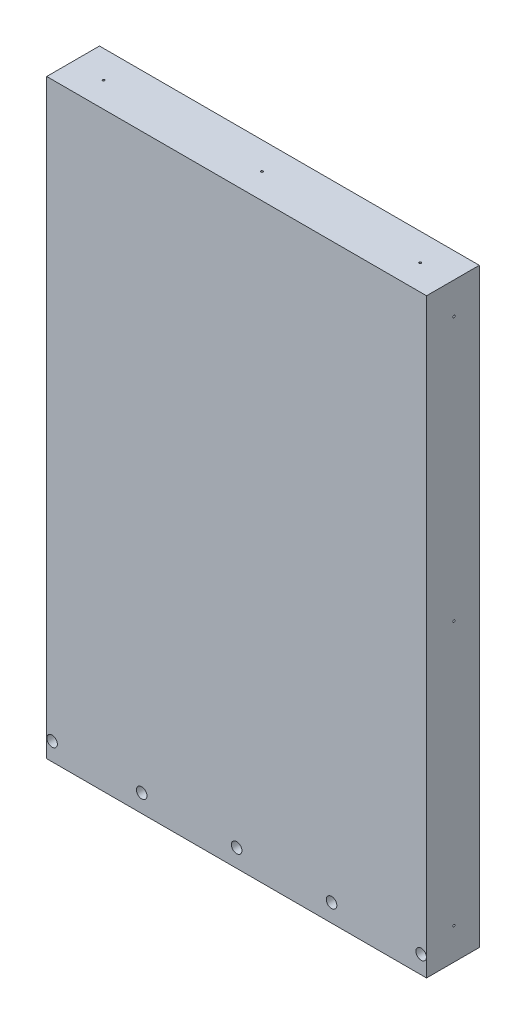
from build123d import *

# Parameters (mm, degrees)
ESBO_O1_W                      = 180
ESBO_O1_H                      = 280
ESBO_O1_R                      = 2.5
RESSALTO_EXTRUS_O3_DEPTH       = 25
FURO_DE_DI_METRO_1_0_1_1_D     = 1
FURO_DE_DI_METRO_1_0_1_1_DEPTH = 10
FURO_DE_DI_METRO_1_0_1_1_TIP   = 0.30043031
FURO_DE_DI_METRO_1_0_1_2_D     = 1
FURO_DE_DI_METRO_1_0_1_2_DEPTH = 10
FURO_DE_DI_METRO_1_0_1_2_TIP   = 0.30043031
FURO_DE_DI_METRO_1_0_1_3_D     = 1
FURO_DE_DI_METRO_1_0_1_3_DEPTH = 10
FURO_DE_DI_METRO_1_0_1_3_TIP   = 0.30043031
FURO_DE_DI_METRO_1_0_1_4_D     = 1
FURO_DE_DI_METRO_1_0_1_4_DEPTH = 10
FURO_DE_DI_METRO_1_0_1_4_TIP   = 0.30043031


with BuildPart() as part:
    # Esboço1 → Ressalto-extrusão3 (new body)
    with BuildSketch(Plane.XY):
        with Locations((90, 140)):
            Rectangle(ESBO_O1_W, ESBO_O1_H)
        with Locations((2.55, 8.5)):
            Circle(ESBO_O1_R, mode=Mode.SUBTRACT)
        with Locations((45, 8.5)):
            Circle(ESBO_O1_R, mode=Mode.SUBTRACT)
        with Locations((90, 8.5)):
            Circle(ESBO_O1_R, mode=Mode.SUBTRACT)
        with Locations((135, 8.5)):
            Circle(ESBO_O1_R, mode=Mode.SUBTRACT)
        with Locations((177.45, 8.5)):
            Circle(ESBO_O1_R, mode=Mode.SUBTRACT)
    extrude(amount=RESSALTO_EXTRUS_O3_DEPTH)

    # Furo de diâmetro Ø1.0 (1)1
    with Locations(Plane(origin=(0, 265, 12), x_dir=(0, 0, -1), z_dir=(-1, 0, 0))):
        with Locations((0, 0), (0, 125), (0, 250)):
            Hole(FURO_DE_DI_METRO_1_0_1_1_D / 2, depth=FURO_DE_DI_METRO_1_0_1_1_DEPTH)
            with Locations((0, 0, -(FURO_DE_DI_METRO_1_0_1_1_DEPTH + FURO_DE_DI_METRO_1_0_1_1_TIP / 2))):  # 118° drill point
                Cone(0, FURO_DE_DI_METRO_1_0_1_1_D / 2, FURO_DE_DI_METRO_1_0_1_1_TIP, mode=Mode.SUBTRACT)

    # Furo de diâmetro Ø1.0 (1)2
    with Locations(Plane(origin=(180, 0, 0), x_dir=(0, 0, -1), z_dir=(1, 0, 0))):
        with Locations((-12, 15), (-12, 140), (-12, 265)):
            Hole(FURO_DE_DI_METRO_1_0_1_2_D / 2, depth=FURO_DE_DI_METRO_1_0_1_2_DEPTH)
            with Locations((0, 0, -(FURO_DE_DI_METRO_1_0_1_2_DEPTH + FURO_DE_DI_METRO_1_0_1_2_TIP / 2))):  # 118° drill point
                Cone(0, FURO_DE_DI_METRO_1_0_1_2_D / 2, FURO_DE_DI_METRO_1_0_1_2_TIP, mode=Mode.SUBTRACT)

    # Furo de diâmetro Ø1.0 (1)3
    with Locations(Plane(origin=(15, 0, 13), x_dir=(0, 0, -1), z_dir=(0, -1, 0))):
        with Locations((0, 0), (0, 75), (0, 150)):
            Hole(FURO_DE_DI_METRO_1_0_1_3_D / 2, depth=FURO_DE_DI_METRO_1_0_1_3_DEPTH)
            with Locations((0, 0, -(FURO_DE_DI_METRO_1_0_1_3_DEPTH + FURO_DE_DI_METRO_1_0_1_3_TIP / 2))):  # 118° drill point
                Cone(0, FURO_DE_DI_METRO_1_0_1_3_D / 2, FURO_DE_DI_METRO_1_0_1_3_TIP, mode=Mode.SUBTRACT)

    # Furo de diâmetro Ø1.0 (1)4
    with Locations(Plane(origin=(0, 280, 0), x_dir=(1, 0, 0), z_dir=(0, 1, 0))):
        with Locations((15, -13), (90, -13), (165, -13)):
            Hole(FURO_DE_DI_METRO_1_0_1_4_D / 2, depth=FURO_DE_DI_METRO_1_0_1_4_DEPTH)
            with Locations((0, 0, -(FURO_DE_DI_METRO_1_0_1_4_DEPTH + FURO_DE_DI_METRO_1_0_1_4_TIP / 2))):  # 118° drill point
                Cone(0, FURO_DE_DI_METRO_1_0_1_4_D / 2, FURO_DE_DI_METRO_1_0_1_4_TIP, mode=Mode.SUBTRACT)


solid = part.part
